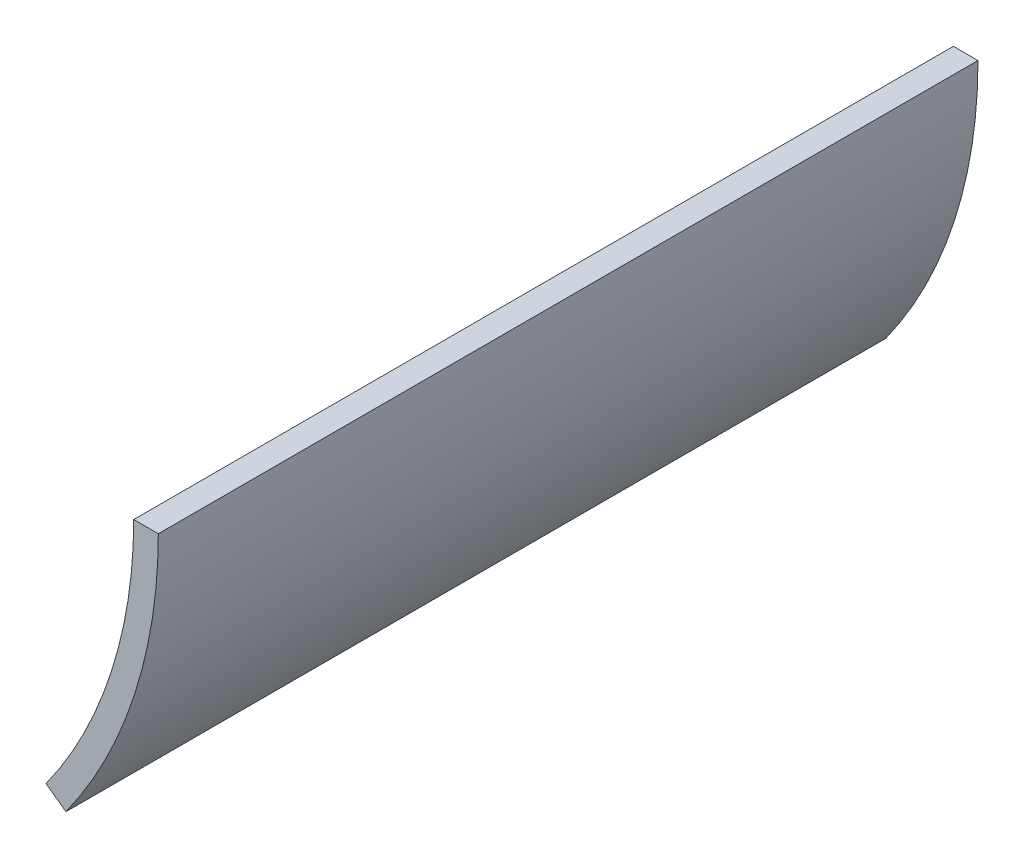
from build123d import *

# Parameters (mm, degrees)
BOSS_EXTRUDE1_DEPTH = 500


with BuildPart() as part:
    # Sketch1 → Boss-Extrude1 (new body)
    with BuildSketch(Plane.XY):
        with BuildLine():
            Line((0, 0), (15, 0))
            ThreePointArc((15, 0), (0.570444537, -91.921277227), (-41.33014138, -175))
            Line((-41.33014138, -175), (-53.513634311, -166.25))
            ThreePointArc((-53.513634311, -166.25), (-13.70807769, -87.325213365), (0, 0))
        make_face()
    extrude(amount=BOSS_EXTRUDE1_DEPTH)


solid = part.part
